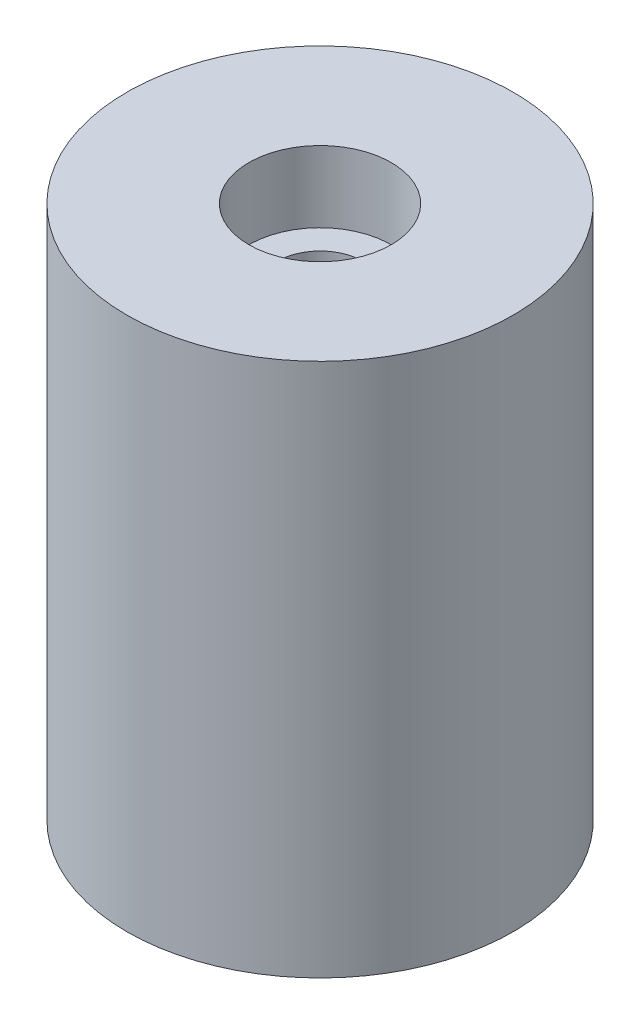
from build123d import *

# Parameters (mm, degrees)
SKETCH1_R                      = 10.85
BOSS_EXTRUDE1_DEPTH            = 30
CBORE_FOR_M4_SHCS1_D           = 4.8
CBORE_FOR_M4_SHCS1_CBORE_D     = 8
CBORE_FOR_M4_SHCS1_CBORE_DEPTH = 4


with BuildPart() as part:
    # Sketch1 → Boss-Extrude1 (new body)
    with BuildSketch(Plane(origin=(0, 0, 0), x_dir=(1, 0, 0), z_dir=(0, 1, 0))):
        with Locations(Location((0, 0, 0), (0, 0, 270))):
            Circle(SKETCH1_R)
    extrude(amount=BOSS_EXTRUDE1_DEPTH)

    # CBORE for M4 SHCS1 (through all)
    with Locations(Plane(origin=(0, 30, 0), x_dir=(1, 0, 0), z_dir=(0, 1, 0))):
        with Locations((0, 0)):
            CounterBoreHole(CBORE_FOR_M4_SHCS1_D / 2, CBORE_FOR_M4_SHCS1_CBORE_D / 2, CBORE_FOR_M4_SHCS1_CBORE_DEPTH)


solid = part.part
